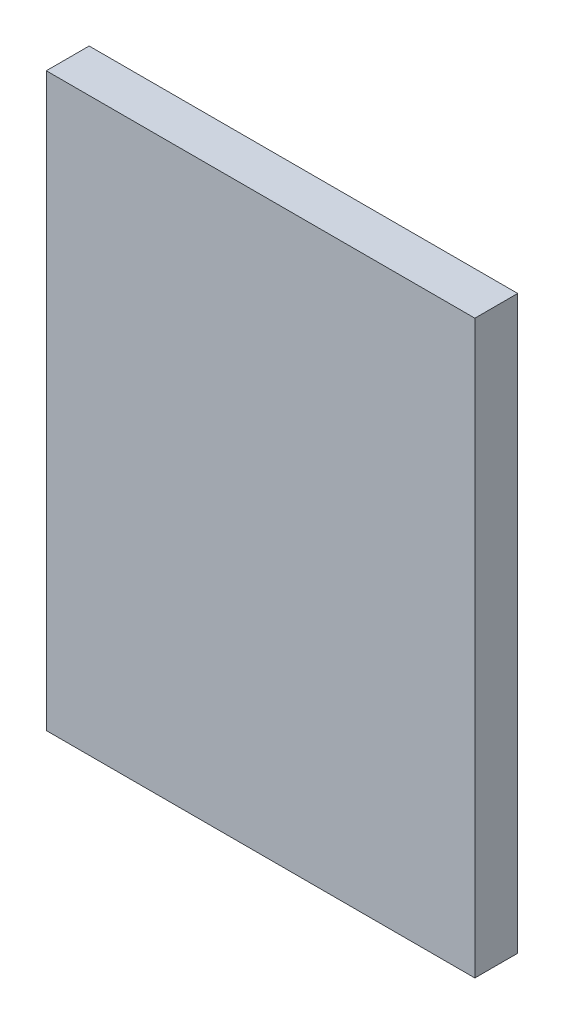
from build123d import *

# Parameters (mm, degrees)
SCHIZZO1_W                   = 300
SCHIZZO1_H                   = 400
ESTRUSIONE_ESTRUSIONE1_DEPTH = 30


with BuildPart() as part:
    # Schizzo1 → Estrusione-Estrusione1 (new body)
    with BuildSketch(Plane.XY):
        with Locations((150, -200)):
            Rectangle(SCHIZZO1_W, SCHIZZO1_H)
    extrude(amount=ESTRUSIONE_ESTRUSIONE1_DEPTH)


solid = part.part
